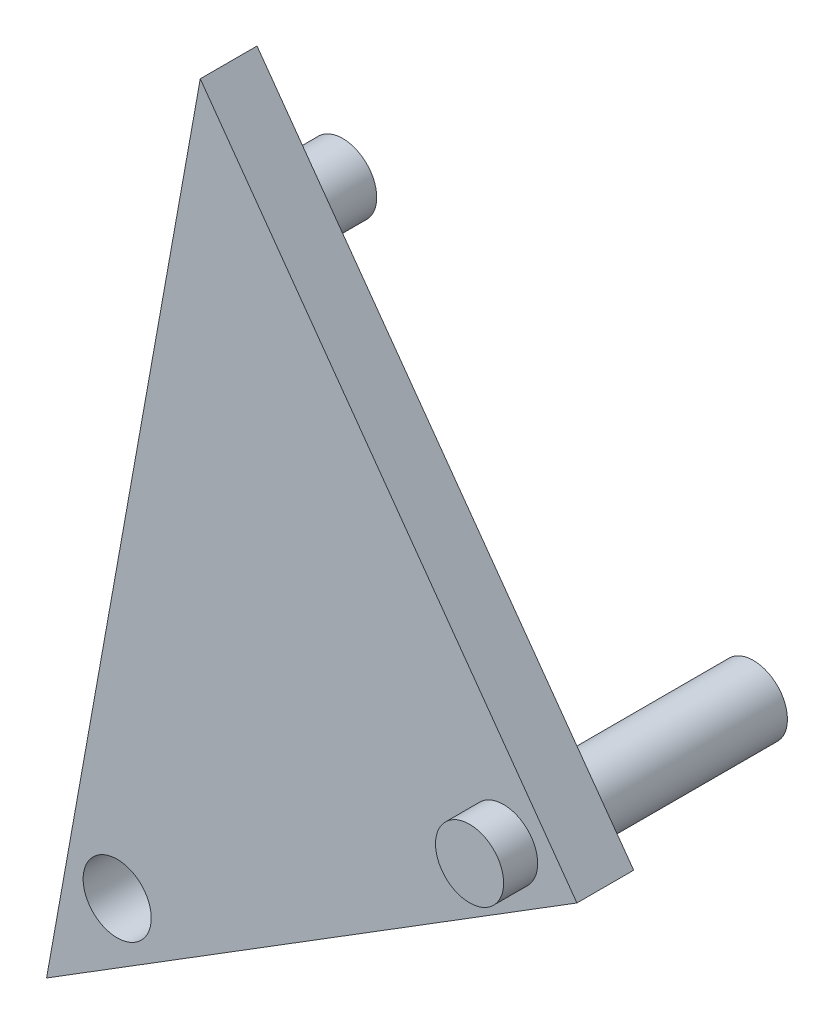
from build123d import *

# Parameters (mm, degrees)
SKETCH1_R           = 3
BOSS_EXTRUDE1_DEPTH = 5
BOSS_EXTRUDE2_START = -10
SKETCH2_R           = 3
BOSS_EXTRUDE2_DEPTH = 10
BOSS_EXTRUDE3_START = -22
SKETCH3_R           = 3
BOSS_EXTRUDE3_DEPTH = 22
SKETCH4_R           = 3
BOSS_EXTRUDE4_DEPTH = 3


with BuildPart() as part:
    # Sketch1 → Boss-Extrude1 (new body)
    with BuildSketch(Plane.XY):
        Polygon((-26.724502293, 45.005919314), (-40.262558922, -30.363907626), (6.455683288, -1.282016359), align=None)
        with Locations((-24.177985347, 33.729438545)):
            Circle(SKETCH1_R, mode=Mode.SUBTRACT)
        Circle(SKETCH1_R, mode=Mode.SUBTRACT)
        with Locations((-34.042997525, -21.191609649)):
            Circle(SKETCH1_R, mode=Mode.SUBTRACT)
    extrude(amount=BOSS_EXTRUDE1_DEPTH)

    # Sketch2 → Boss-Extrude2 (add)
    with BuildSketch(Plane.XY.offset(5).offset(BOSS_EXTRUDE2_START)):
        with Locations((-24.177985347, 33.729438545)):
            Circle(SKETCH2_R)
    extrude(amount=BOSS_EXTRUDE2_DEPTH)

    # Sketch3 → Boss-Extrude3 (add)
    with BuildSketch(Plane.XY.offset(5).offset(BOSS_EXTRUDE3_START)):
        Circle(SKETCH3_R)
    extrude(amount=BOSS_EXTRUDE3_DEPTH)

    # Sketch4 → Boss-Extrude4 (add)
    with BuildSketch(Plane.XY.offset(5)):
        Circle(SKETCH4_R)
    extrude(amount=BOSS_EXTRUDE4_DEPTH)


solid = part.part
